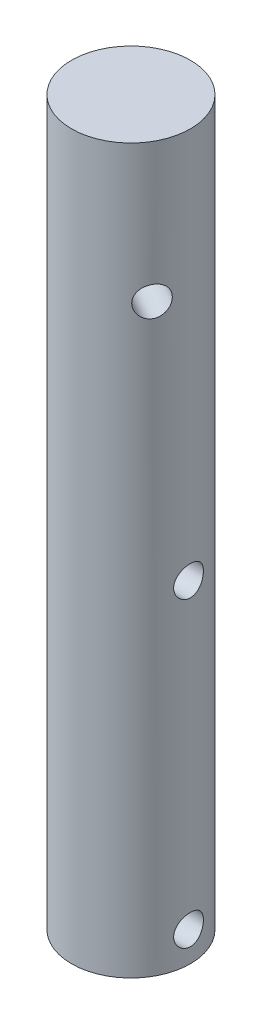
from build123d import *

# Parameters (mm, degrees)
TWELVE_MILLIMETRE_AXLE_STOCK_SKETCH_R = 6
TWELVE_MILLIMETRE_AXLE_STOCK_DEPTH    = 73
FRONT_COLLAR_PIN_SKETCH_R             = 1.5
FRONT_COLLAR_PIN_DEPTH                = 14
REAR_COLLAR_PIN_SKETCH_R              = 1.5
REAR_COLLAR_PIN_DEPTH                 = 14
HUB_DRIVE_PIN_SKETCH_R                = 1.5
HUB_DRIVE_PIN_DEPTH                   = 14


with BuildPart() as part:
    # Twelve millimetre axle stock sketch → Twelve millimetre axle stock (new body)
    with BuildSketch(Plane(origin=(0, -283, 0), x_dir=(1, 0, 0), z_dir=(0, 1, 0))):
        with Locations(Location((-19.009182883, 53.244882879, 0), (0, 0, 270))):
            Circle(TWELVE_MILLIMETRE_AXLE_STOCK_SKETCH_R)
    extrude(amount=TWELVE_MILLIMETRE_AXLE_STOCK_DEPTH)

    # Front collar pin sketch → Front collar pin (cut)
    with BuildSketch(Plane(origin=(-26.009182883, 0, 0), x_dir=(0, 0, -1), z_dir=(1, 0, 0))):
        with Locations(Location((53.244882879, -213, 0), (0, 0, 180))):
            Circle(FRONT_COLLAR_PIN_SKETCH_R)
    extrude(amount=FRONT_COLLAR_PIN_DEPTH, mode=Mode.SUBTRACT)

    # Rear collar pin sketch → Rear collar pin (cut)
    with BuildSketch(Plane(origin=(-26.009182883, 0, 0), x_dir=(0, 0, -1), z_dir=(1, 0, 0))):
        with Locations(Location((53.244882879, -243.5, 0), (0, 0, 180))):
            Circle(REAR_COLLAR_PIN_SKETCH_R)
    extrude(amount=REAR_COLLAR_PIN_DEPTH, mode=Mode.SUBTRACT)

    # Hub drive pin sketch → Hub drive pin (cut)
    with BuildSketch(Plane(origin=(-43.374775586, 0, -25.042438361), x_dir=(0.5000000000000001, 0, -0.8660254037844386), z_dir=(0.8660254037844386, 0, 0.5000000000000001))):
        with Locations(Location((36.606829753, -269, 0), (0, 0, 180))):
            Circle(HUB_DRIVE_PIN_SKETCH_R)
    extrude(amount=HUB_DRIVE_PIN_DEPTH, mode=Mode.SUBTRACT)


with BuildPart() as body_2:
    # Mirror1: mirrored copy
    add(part.part.mirror(Plane(origin=(0, 0, 0), x_dir=(0, 0, 1), z_dir=(0, -1, 0))))


solid = body_2.part
